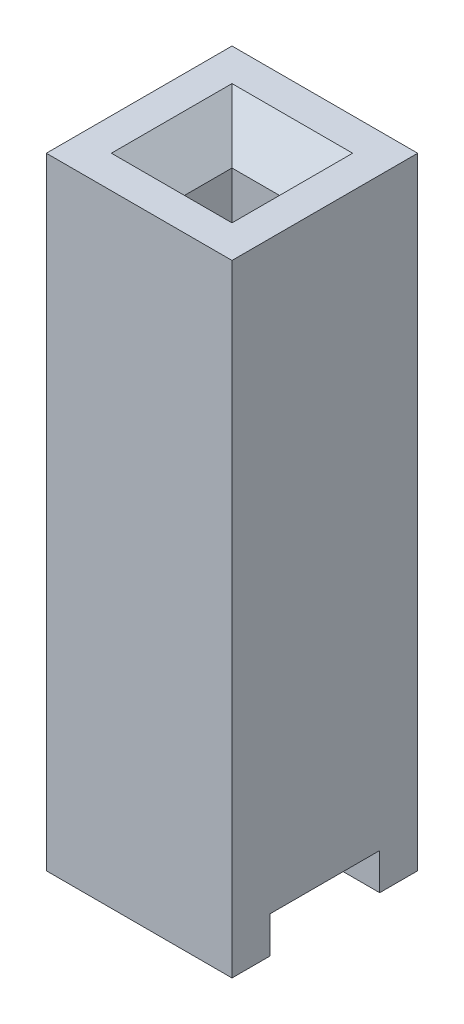
from build123d import *

# Parameters (mm, degrees)
SKETCH_1_W      = 2.54
SKETCH_1_H      = 2.54
EXTRUDE_1_DEPTH = 8.5
SKETCH_2_W      = 3
SKETCH_2_H      = 1.5
EXTRUDE_2_DEPTH = 0.5
SKETCH_3_W      = 0.6
SKETCH_3_H      = 0.6
EXTRUDE_3_DEPTH = 0.7
SKETCH_5_W      = 0.65
SKETCH_5_H      = 0.65
EXTRUDE_4_DEPTH = 7
CHAMFER_1_SIZE  = 0.5


with BuildPart() as part:
    # Эскиз1 → Бобышка-Вытянуть1 (new body)
    with BuildSketch(Plane(origin=(0, 0, 0), x_dir=(1, 0, 0), z_dir=(0, 1, 0))):
        Rectangle(SKETCH_1_W, SKETCH_1_H)
    extrude(amount=EXTRUDE_1_DEPTH)


with BuildPart() as body_2:
    # Эскиз2 → Бобышка-Вытянуть2 (new body)
    with BuildSketch(Plane(origin=(0, 0, 0), x_dir=(1, 0, 0), z_dir=(0, 1, 0))):
        Rectangle(SKETCH_2_W, SKETCH_2_H)
    extrude(amount=EXTRUDE_2_DEPTH)


with BuildPart() as part_1:
    add(part.part)

    # Combine 2: cut body 2
    add(body_2.part, mode=Mode.SUBTRACT)


with BuildPart() as body_2_2:
    # Эскиз3 → Бобышка-Вытянуть3 (new body)
    with BuildSketch(Plane.XZ.offset(-0.5)):
        Rectangle(SKETCH_3_W, SKETCH_3_H)
    extrude(amount=EXTRUDE_3_DEPTH)


with BuildPart() as body_3:
    # Эскиз5 → Бобышка-Вытянуть4 (new body)
    with BuildSketch(Plane(origin=(0, 8.5, 0), x_dir=(1, 0, 0), z_dir=(0, 1, 0))):
        Rectangle(SKETCH_5_W, SKETCH_5_H)
    extrude(amount=-EXTRUDE_4_DEPTH)


with BuildPart() as part_2:
    add(part_1.part)

    # Combine 3: cut body 3
    add(body_3.part, mode=Mode.SUBTRACT)

    # Фаска1
    chamfer_1_edges = [part_2.edges().sort_by_distance(p)[0] for p in [
        (0.325, 8.5, 0),
        (0, 8.5, -0.325),
        (-0.325, 8.5, 0),
        (0, 8.5, 0.325),
    ]]
    chamfer(chamfer_1_edges, length=CHAMFER_1_SIZE)


solid = Compound([body_2_2.part, part_2.part])
